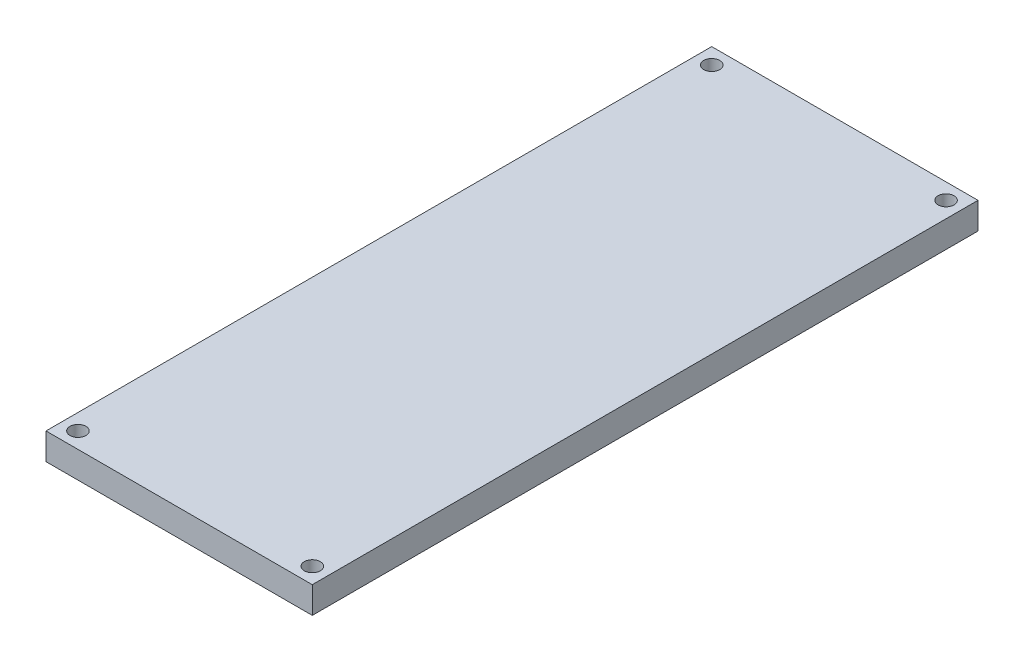
from build123d import *

# Parameters (mm, degrees)
SKETCH1_W           = 50
SKETCH1_H           = 125
BOSS_EXTRUDE1_DEPTH = 5
SKETCH2_R           = 1.5
CUT_EXTRUDE2_DEPTH  = 135.721935853


with BuildPart() as part:
    # Sketch1 → Boss-Extrude1 (new body)
    with BuildSketch(Plane(origin=(0, 0, 0), x_dir=(1, 0, 0), z_dir=(0, 1, 0))):
        with Locations((25, 62.5)):
            Rectangle(SKETCH1_W, SKETCH1_H)
    extrude(amount=BOSS_EXTRUDE1_DEPTH)

    # Sketch2 → Cut-Extrude2 (cut, through all)
    with BuildSketch(Plane(origin=(0, 5, 0), x_dir=(1, 0, 0), z_dir=(0, 1, 0))):
        with Locations(Location((3, 122, 0), (0, 0, 270))):
            Circle(SKETCH2_R)
        with Locations(Location((47, 122, 0), (0, 0, 270))):
            Circle(SKETCH2_R)
        with Locations(Location((3, 3, 0), (0, 0, 270))):
            Circle(SKETCH2_R)
        with Locations(Location((47, 3, 0), (0, 0, 270))):
            Circle(SKETCH2_R)
    extrude(amount=-CUT_EXTRUDE2_DEPTH, mode=Mode.SUBTRACT)


solid = part.part
